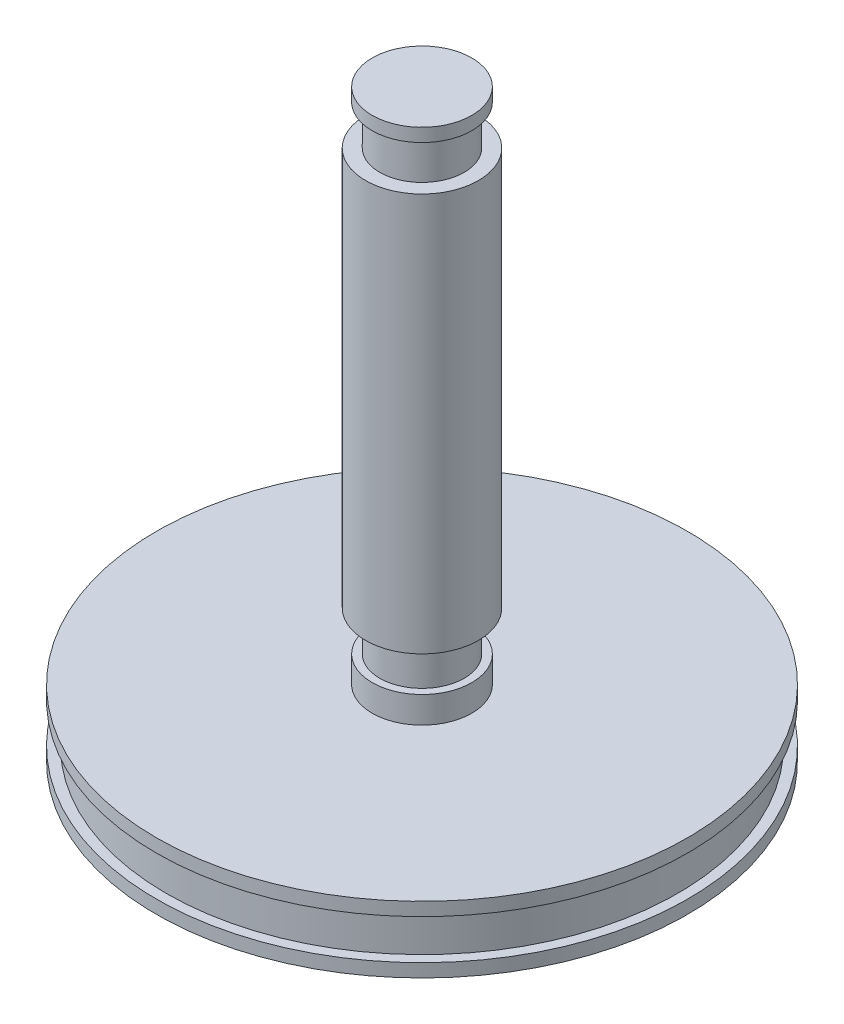
from build123d import *

# Parameters (mm, degrees)
SKETCH1_R           = 38.515
BOSS_EXTRUDE1_DEPTH = 10
SKETCH2_R           = 40
BOSS_EXTRUDE2_DEPTH = 2
BOSS_EXTRUDE3_START = -2
SKETCH3_R           = 40
BOSS_EXTRUDE3_DEPTH = 2
SKETCH4_R           = 6.366
BOSS_EXTRUDE4_DEPTH = 78
SKETCH5_R           = 7.5
BOSS_EXTRUDE5_DEPTH = 2
SKETCH6_R           = 8.5
BOSS_EXTRUDE6_DEPTH = 60
BOSS_EXTRUDE7_START = 4
SKETCH7_R           = 7.5
BOSS_EXTRUDE7_DEPTH = 4


with BuildPart() as part:
    # Sketch1 → Boss-Extrude1 (new body)
    with BuildSketch(Plane(origin=(0, 0, 0), x_dir=(1, 0, 0), z_dir=(0, 1, 0))):
        with Locations(Location((0, 0, 0), (0, 0, 270))):
            Circle(SKETCH1_R)
    extrude(amount=BOSS_EXTRUDE1_DEPTH)

    # Sketch2 → Boss-Extrude2 (add)
    with BuildSketch(Plane.XZ):
        with Locations(Location((0, 0, 0), (0, 0, 270))):
            Circle(SKETCH2_R)
    extrude(amount=-BOSS_EXTRUDE2_DEPTH)

    # Sketch3 → Boss-Extrude3 (add)
    with BuildSketch(Plane(origin=(0, 10, 0), x_dir=(1, 0, 0), z_dir=(0, 1, 0)).offset(BOSS_EXTRUDE3_START)):
        with Locations(Location((0, 0, 0), (0, 0, 90))):
            Circle(SKETCH3_R)
    extrude(amount=BOSS_EXTRUDE3_DEPTH)

    # Sketch4 → Boss-Extrude4 (add)
    with BuildSketch(Plane(origin=(0, 10, 0), x_dir=(1, 0, 0), z_dir=(0, 1, 0))):
        with Locations(Location((0, 0, 0), (0, 0, 270))):
            Circle(SKETCH4_R)
    extrude(amount=BOSS_EXTRUDE4_DEPTH)

    # Sketch5 → Boss-Extrude5 (add)
    with BuildSketch(Plane(origin=(0, 88, 0), x_dir=(1, 0, 0), z_dir=(0, 1, 0))):
        with Locations(Location((0, 0, 0), (0, 0, 270))):
            Circle(SKETCH5_R)
    extrude(amount=-BOSS_EXTRUDE5_DEPTH)

    # Sketch6 → Boss-Extrude6 (add)
    with BuildSketch(Plane(origin=(0, 80, 0), x_dir=(-1, 0, 0), z_dir=(0, -1, 0))):
        with Locations(Location((0, 0, 0), (0, 0, 90))):
            Circle(SKETCH6_R)
    extrude(amount=BOSS_EXTRUDE6_DEPTH)

    # Sketch7 → Boss-Extrude7 (add)
    with BuildSketch(Plane(origin=(0, 10, 0), x_dir=(1, 0, 0), z_dir=(0, 1, 0)).offset(BOSS_EXTRUDE7_START)):
        with Locations(Location((0, 0, 0), (0, 0, 270))):
            Circle(SKETCH7_R)
    extrude(amount=-BOSS_EXTRUDE7_DEPTH)


solid = part.part
